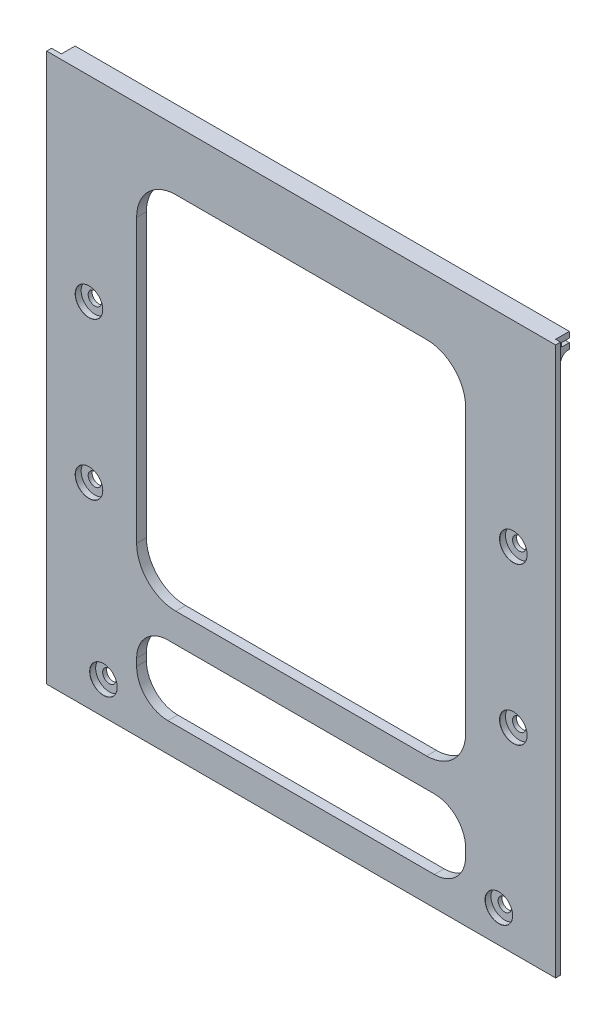
from build123d import *

# Parameters (mm, degrees)
ESBO_O1_W                                      = 130
ESBO_O1_H                                      = 140.05
RESSALTO_EXTRUS_O1_DEPTH                       = 2.5
ESBO_O2_W                                      = 130
ESBO_O2_H                                      = 4
RESSALTO_EXTRUS_O2_DEPTH                       = 2.25
FILETE1_R                                      = 2
ESBO_O3_W                                      = 130
ESBO_O3_H                                      = 1
CORTE_EXTRUS_O1_DEPTH                          = 2
ESBO_O6_W                                      = 1.25
ESBO_O6_H                                      = 140.05
CORTE_EXTRUS_O2_DEPTH                          = 3.5
ESBO_O8_W                                      = 1.25
ESBO_O8_H                                      = 3.5
CORTE_EXTRUS_O3_DEPTH                          = 6.25
REBAIXO_PARA_PARAFUSO_COM_CABE_A_PAN_2_COUNT   = 2
REBAIXO_PARA_PARAFUSO_COM_CABE_A_PAN_2_PITCH   = 40
REBAIXO_PARA_PARAFUSO_COM_CABE_A_PAN_3_COUNT   = 2
REBAIXO_PARA_PARAFUSO_COM_CABE_A_PAN_3_PITCH   = 108.4
REBAIXO_PARA_PARAFUSO_COM_CABE_A_PAN_4_COUNT   = 2
REBAIXO_PARA_PARAFUSO_COM_CABE_A_PAN_4_PITCH   = 115.544623415
CORTE_EXTRUS_O5_DEPTH                          = 8.25
REBAIXO_PARA_PARAFUSO_COM_CABE_A_PAN_5_A_COUNT = 2
REBAIXO_PARA_PARAFUSO_COM_CABE_A_PAN_5_A_PITCH = 101


with BuildPart() as part:
    # Esboço1 → Ressalto-extrusão1 (new body)
    with BuildSketch(Plane.XY):
        with Locations((0.510662177, -29.099074074)):
            Rectangle(ESBO_O1_W, ESBO_O1_H)
    extrude(amount=RESSALTO_EXTRUS_O1_DEPTH)

    # Esboço2 → Ressalto-extrusão2 (add)
    with BuildSketch(Plane(origin=(0, 0, 0), x_dir=(-1, 0, 0), z_dir=(0, 0, -1))):
        with Locations((-0.510662177, 38.925925926)):
            Rectangle(ESBO_O2_W, ESBO_O2_H)
    extrude(amount=RESSALTO_EXTRUS_O2_DEPTH)

    # Filete1
    filete1_edges = [part.edges().sort_by_distance(p)[0] for p in [
        (0.510662177, 36.925925926, 0),
    ]]
    fillet(filete1_edges, radius=FILETE1_R)

    # Esboço3 → Corte-extrusão1 (cut)
    with BuildSketch(Plane(origin=(0, 0, -2.25), x_dir=(-1, 0, 0), z_dir=(0, 0, -1))):
        with Locations((-0.510662177, 38.925925926)):
            Rectangle(ESBO_O3_W, ESBO_O3_H)
    extrude(amount=-CORTE_EXTRUS_O1_DEPTH, mode=Mode.SUBTRACT)

    # Esboço6 → Corte-extrusão2 (cut)
    with BuildSketch(Plane(origin=(0, 0, -2.25), x_dir=(-1, 0, 0), z_dir=(0, 0, -1))):
        with Locations((-64.885662177, -29.099074074)):
            Rectangle(ESBO_O6_W, ESBO_O6_H)
        with Locations((63.864337823, -29.099074074)):
            Rectangle(ESBO_O6_W, ESBO_O6_H)
    extrude(amount=-CORTE_EXTRUS_O2_DEPTH, mode=Mode.SUBTRACT)

    # Esboço8 → Corte-extrusão3 (cut)
    with BuildSketch(Plane(origin=(0, 40.925925926, 0), x_dir=(1, 0, 0), z_dir=(0, 1, 0))):
        with Locations((-62.614337823, 0.5)):
            Rectangle(ESBO_O8_W, ESBO_O8_H)
    extrude(amount=-CORTE_EXTRUS_O3_DEPTH, mode=Mode.SUBTRACT)

    # Esboço12 → Rebaixo para parafuso com cabe_a panela (revolve, cut)
    with BuildSketch(Plane(origin=(-53.689337823, -9.124074074, 2.5), x_dir=(0, -1, 0), z_dir=(1, 0, 0))):
        Polygon((0, 0), (0, 4.75), (1.7, 4.75), (1.7, 1.5), (3.5, 1.5), (3.5, 0.025), (3.525, 0), align=None)
    rebaixo_para_parafuso_com_cabe_a_panela = revolve(axis=Axis((-53.689337823, -9.124074074, 8.85), (0, 0, -1)), mode=Mode.SUBTRACT)

    # Rebaixo para parafuso com cabe_a pan 2: Rebaixo para parafuso com cabe_a panela ×2
    with Locations(*[(0, -i * REBAIXO_PARA_PARAFUSO_COM_CABE_A_PAN_2_PITCH, 0) for i in range(1, REBAIXO_PARA_PARAFUSO_COM_CABE_A_PAN_2_COUNT)]):
        add(rebaixo_para_parafuso_com_cabe_a_panela, mode=Mode.SUBTRACT)

    # Rebaixo para parafuso com cabe_a pan 3: Rebaixo para parafuso com cabe_a panela ×2
    with Locations(*[(i * REBAIXO_PARA_PARAFUSO_COM_CABE_A_PAN_3_PITCH, 0, 0) for i in range(1, REBAIXO_PARA_PARAFUSO_COM_CABE_A_PAN_3_COUNT)]):
        add(rebaixo_para_parafuso_com_cabe_a_panela, mode=Mode.SUBTRACT)

    # Rebaixo para parafuso com cabe_a pan 4: Rebaixo para parafuso com cabe_a panela ×2
    with Locations(*[Vector(0.9381656783035653, -0.3461865971599872, 0) * (i * REBAIXO_PARA_PARAFUSO_COM_CABE_A_PAN_4_PITCH) for i in range(1, REBAIXO_PARA_PARAFUSO_COM_CABE_A_PAN_4_COUNT)]):
        add(rebaixo_para_parafuso_com_cabe_a_panela, mode=Mode.SUBTRACT)

    # Esboço13 → Corte-extrusão5 (cut)
    with BuildSketch(Plane.XY.offset(2.5)):
        with BuildLine():
            Line((32.535999817, -66.48621762), (-31.514675462, -66.48621762))
            ThreePointArc((-31.514675462, -66.48621762), (-38.585743274, -63.557285432), (-41.514675462, -56.48621762))
            Line((-41.514675462, -56.48621762), (-41.514675462, 15.639195022))
            ThreePointArc((-41.514675462, 15.639195022), (-38.585743274, 22.710262834), (-31.514675462, 25.639195022))
            Line((-31.514675462, 25.639195022), (32.535999817, 25.639195022))
            ThreePointArc((32.535999817, 25.639195022), (39.607067629, 22.710262834), (42.535999817, 15.639195022))
            Line((42.535999817, 15.639195022), (42.535999817, -56.48621762))
            ThreePointArc((42.535999817, -56.48621762), (39.607067629, -63.557285432), (32.535999817, -66.48621762))
        make_face()
        with BuildLine():
            Line((34.535999817, -91.70501851), (-33.514675462, -91.70501851))
            ThreePointArc((-33.514675462, -91.70501851), (-39.171529712, -89.361872759), (-41.514675462, -83.70501851))
            Line((-41.514675462, -83.70501851), (-41.514675462, -81.880603518))
            ThreePointArc((-41.514675462, -81.880603518), (-39.171529712, -76.223749269), (-33.514675462, -73.880603518))
            Line((-33.514675462, -73.880603518), (34.535999817, -73.880603518))
            ThreePointArc((34.535999817, -73.880603518), (40.192854066, -76.223749269), (42.535999817, -81.880603518))
            Line((42.535999817, -81.880603518), (42.535999817, -83.70501851))
            ThreePointArc((42.535999817, -83.70501851), (40.192854066, -89.361872759), (34.535999817, -91.70501851))
        make_face()
    extrude(amount=-CORTE_EXTRUS_O5_DEPTH, mode=Mode.SUBTRACT)

    # Esboço16 → Rebaixo para parafuso com cabe_a pan 5 (revolve, cut)
    with BuildSketch(Plane(origin=(-49.989337823, -90.824074074, 2.5), x_dir=(0, -1, 0), z_dir=(1, 0, 0))):
        Polygon((0, 0), (0, 4.75), (1.7, 4.75), (1.7, 1.5), (3.5, 1.5), (3.5, 0.025), (3.525, 0), align=None)
    rebaixo_para_parafuso_com_cabe_a_pan_5 = revolve(axis=Axis((-49.989337823, -90.824074074, 8.85), (0, 0, -1)), mode=Mode.SUBTRACT)

    # Rebaixo para parafuso com cabe_a pan 5 a: Rebaixo para parafuso com cabe_a pan 5 ×2
    with Locations(*[(i * REBAIXO_PARA_PARAFUSO_COM_CABE_A_PAN_5_A_PITCH, 0, 0) for i in range(1, REBAIXO_PARA_PARAFUSO_COM_CABE_A_PAN_5_A_COUNT)]):
        add(rebaixo_para_parafuso_com_cabe_a_pan_5, mode=Mode.SUBTRACT)


solid = part.part
